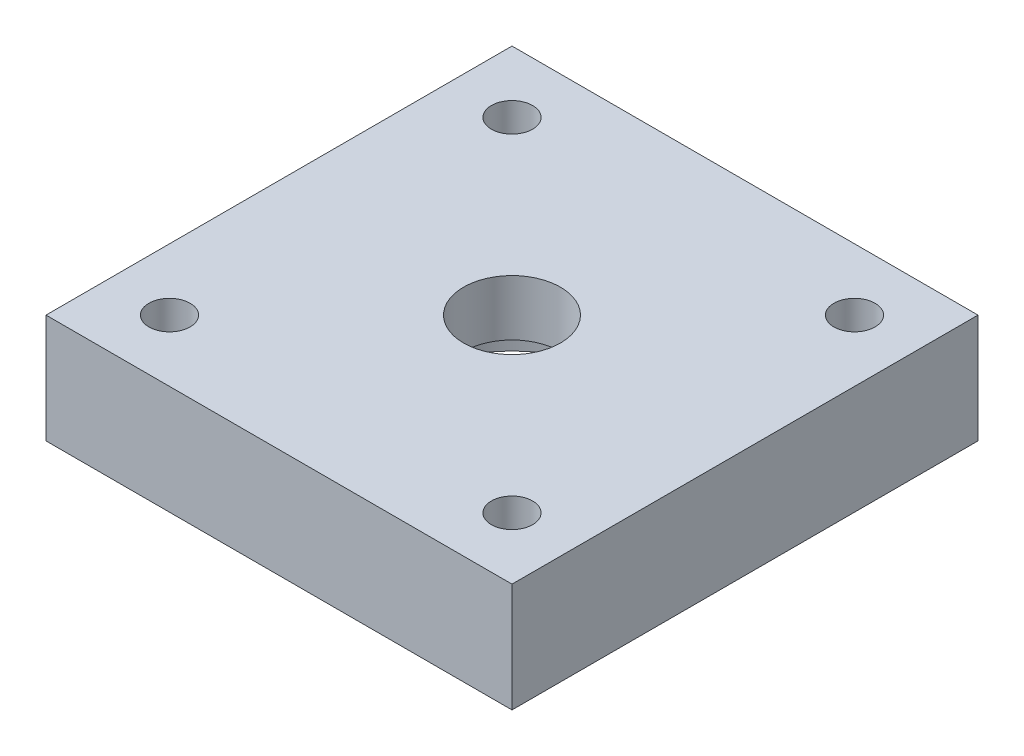
from build123d import *

# Parameters (mm, degrees)
SKETCH1_W                           = 96.210678118
SKETCH1_H                           = 96.210678118
SKETCH1_R                           = 4.25
BODY_EXTRUSION_AND_BOLT_HOLES_DEPTH = 22.5
SKETCH3_R                           = 10
ENTRANCE_DEPTH                      = 22.5
SKETCH5_R                           = 2.5
CUT_EXTRUDE1_DEPTH                  = 100


with BuildPart() as part:
    # Sketch1 → body extrusion and bolt holes (new body)
    with BuildSketch(Plane(origin=(0, 0, 0), x_dir=(1, 0, 0), z_dir=(0, 1, 0))):
        Rectangle(SKETCH1_W, SKETCH1_H)
        with Locations(Location((-35.355339059, 35.355339059, 0), (0, 0, 90))):
            Circle(SKETCH1_R, mode=Mode.SUBTRACT)
        with Locations(Location((35.355339059, 35.355339059, 0), (0, 0, 90))):
            Circle(SKETCH1_R, mode=Mode.SUBTRACT)
        with Locations(Location((35.355339059, -35.355339059, 0), (0, 0, 90))):
            Circle(SKETCH1_R, mode=Mode.SUBTRACT)
        with Locations(Location((-35.355339059, -35.355339059, 0), (0, 0, 90))):
            Circle(SKETCH1_R, mode=Mode.SUBTRACT)
    extrude(amount=BODY_EXTRUSION_AND_BOLT_HOLES_DEPTH)

    # Sketch2 → main chamber (revolve, cut)
    with BuildSketch(Plane.XY):
        Polygon((0, 0), (0, 14.5), (22.725, 6.5), (22.725, 0), align=None)
    revolve(axis=Axis((0, 0, 0), (0, 1, 0)), mode=Mode.SUBTRACT)

    # Sketch3 → entrance (cut)
    with BuildSketch(Plane(origin=(0, 22.5, 0), x_dir=(1, 0, 0), z_dir=(0, 1, 0))):
        with Locations(Location((0, 0, 0), (0, 0, 270))):
            Circle(SKETCH3_R)
    extrude(amount=-ENTRANCE_DEPTH, mode=Mode.SUBTRACT)

    # Sketch5 → Cut-Extrude1 (cut)
    with BuildSketch(Plane(origin=(0, 0, 0), x_dir=(0, 0, -1), z_dir=(1, 0, 0))):
        with Locations((-20.225, 4)):
            Circle(SKETCH5_R)
    extrude(amount=-CUT_EXTRUDE1_DEPTH, mode=Mode.SUBTRACT)


solid = part.part
